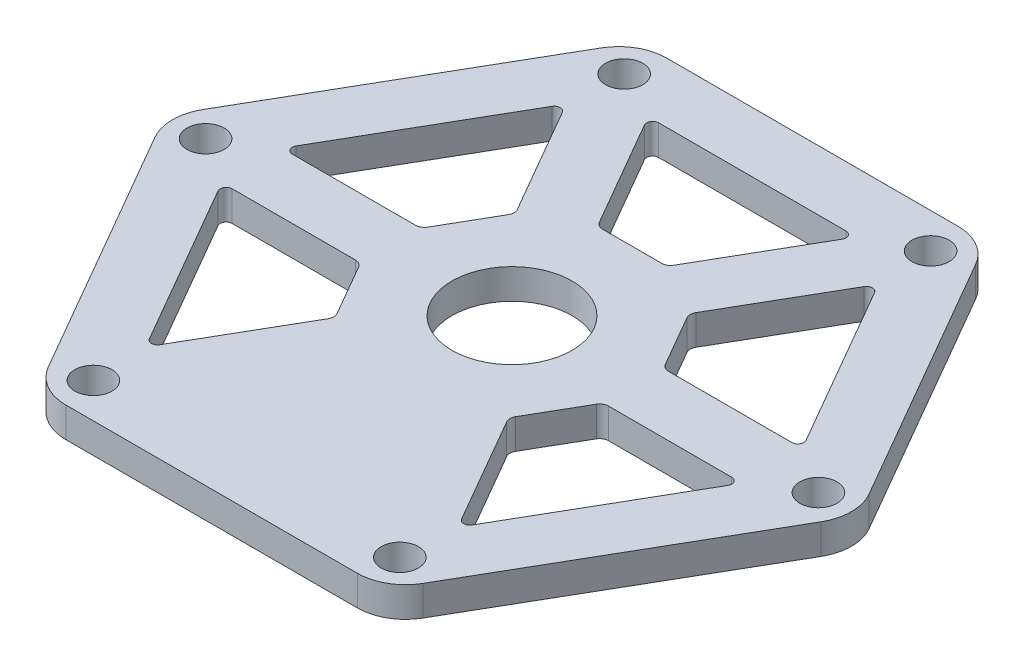
from build123d import *

# Parameters (mm, degrees)
BOSS_EXTRUDE1_DEPTH = 5
FILLET1_R           = 8
SKETCH2_R           = 10
SKETCH2_R_2         = 3.1
CUT_EXTRUDE1_DEPTH  = 10


with BuildPart() as part:
    # Sketch1 → Boss-Extrude1 (new body)
    with BuildSketch(Plane(origin=(0, 0, 0), x_dir=(1, 0, 0), z_dir=(0, 1, 0))):
        Polygon((-57.735026919, 0), (-28.867513459, -50), (28.867513459, -50), (57.735026919, 0), (28.867513459, 50), (-28.867513459, 50), align=None)
    extrude(amount=BOSS_EXTRUDE1_DEPTH)

    # Fillet1
    fillet1_edges = [part.edges().sort_by_distance(p)[0] for p in [
        (-28.867513459, 2.5, -50),
        (28.867513459, 2.5, -50),
        (57.735026919, 2.5, 0),
        (28.867513459, 2.5, 50),
        (-28.867513459, 2.5, 50),
        (-57.735026919, 2.5, 0),
    ]]
    fillet(fillet1_edges, radius=FILLET1_R)

    # Sketch2 → Cut-Extrude1 (cut)
    with BuildSketch(Plane(origin=(0, 5, 0), x_dir=(1, 0, 0), z_dir=(0, 1, 0))):
        with Locations(Location((0, 0, 0), (0, 0, 270))):
            Circle(SKETCH2_R)
        with Locations(Location((-25.5, 44.167295593, 0), (0, 0, 270))):
            Circle(SKETCH2_R_2)
        with Locations(Location((25.5, 44.167295593, 0), (0, 0, 270))):
            Circle(SKETCH2_R_2)
        with Locations(Location((51, 0, 0), (0, 0, 270))):
            Circle(SKETCH2_R_2)
        with Locations(Location((25.5, -44.167295593, 0), (0, 0, 270))):
            Circle(SKETCH2_R_2)
        with Locations(Location((-25.5, -44.167295593, 0), (0, 0, 270))):
            Circle(SKETCH2_R_2)
        with Locations(Location((-51, 0, 0), (0, 0, 270))):
            Circle(SKETCH2_R_2)
        with BuildLine():
            Line((6.206515394, 20.75), (16.454482672, 38.5))
            ThreePointArc((16.454482672, 38.5), (16.454482672, 39.5), (15.588457268, 40))
            Line((15.588457268, 40), (-15.588457268, 40))
            ThreePointArc((-15.588457268, 40), (-16.454482672, 39.5), (-16.454482672, 38.5))
            Line((-16.454482672, 38.5), (-6.206515394, 20.75))
            ThreePointArc((-6.206515394, 20.75), (-5.657477288, 20.200961894), (-4.907477288, 20))
            Line((-4.907477288, 20), (4.907477288, 20))
            ThreePointArc((4.907477288, 20), (5.657477288, 20.200961894), (6.206515394, 20.75))
        make_face()
        with BuildLine():
            Line((21.073284825, 5), (41.569219382, 5))
            ThreePointArc((41.569219382, 5), (42.435244785, 5.5), (42.435244785, 6.5))
            Line((42.435244785, 6.5), (26.846787517, 33.5))
            ThreePointArc((26.846787517, 33.5), (25.980762114, 34), (25.11473671, 33.5))
            Line((25.11473671, 33.5), (14.866769432, 15.75))
            ThreePointArc((14.866769432, 15.75), (14.665807537, 15), (14.866769432, 14.25))
            Line((14.866769432, 14.25), (19.77424672, 5.75))
            ThreePointArc((19.77424672, 5.75), (20.323284825, 5.200961894), (21.073284825, 5))
        make_face()
        with BuildLine():
            Line((14.866769432, -15.75), (25.11473671, -33.5))
            ThreePointArc((25.11473671, -33.5), (25.980762114, -34), (26.846787517, -33.5))
            Line((26.846787517, -33.5), (42.435244785, -6.5))
            ThreePointArc((42.435244785, -6.5), (42.435244785, -5.5), (41.569219382, -5))
            Line((41.569219382, -5), (21.073284825, -5))
            ThreePointArc((21.073284825, -5), (20.323284825, -5.200961894), (19.77424672, -5.75))
            Line((19.77424672, -5.75), (14.866769432, -14.25))
            ThreePointArc((14.866769432, -14.25), (14.665807537, -15), (14.866769432, -15.75))
        make_face()
        with BuildLine():
            Line((-21.073284825, -5), (-41.569219382, -5))
            ThreePointArc((-41.569219382, -5), (-42.435244785, -5.5), (-42.435244785, -6.5))
            Line((-42.435244785, -6.5), (-26.846787517, -33.5))
            ThreePointArc((-26.846787517, -33.5), (-25.980762114, -34), (-25.11473671, -33.5))
            Line((-25.11473671, -33.5), (-14.866769432, -15.75))
            ThreePointArc((-14.866769432, -15.75), (-14.665807537, -15), (-14.866769432, -14.25))
            Line((-14.866769432, -14.25), (-19.77424672, -5.75))
            ThreePointArc((-19.77424672, -5.75), (-20.323284825, -5.200961894), (-21.073284825, -5))
        make_face()
        with BuildLine():
            Line((-14.866769432, 15.75), (-25.11473671, 33.5))
            ThreePointArc((-25.11473671, 33.5), (-25.980762114, 34), (-26.846787517, 33.5))
            Line((-26.846787517, 33.5), (-42.435244785, 6.5))
            ThreePointArc((-42.435244785, 6.5), (-42.435244785, 5.5), (-41.569219382, 5))
            Line((-41.569219382, 5), (-21.073284825, 5))
            ThreePointArc((-21.073284825, 5), (-20.323284825, 5.200961894), (-19.77424672, 5.75))
            Line((-19.77424672, 5.75), (-14.866769432, 14.25))
            ThreePointArc((-14.866769432, 14.25), (-14.665807537, 15), (-14.866769432, 15.75))
        make_face()
    extrude(amount=-CUT_EXTRUDE1_DEPTH, mode=Mode.SUBTRACT)


solid = part.part
